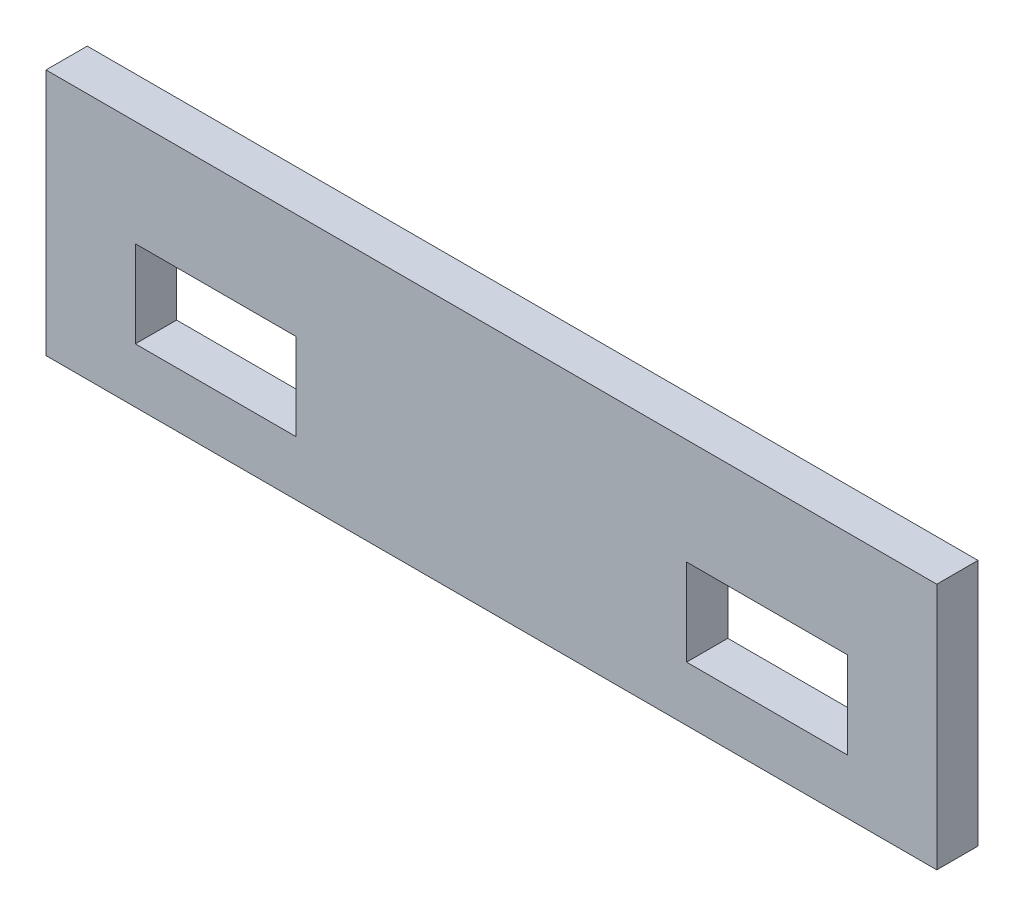
from build123d import *

# Parameters (mm, degrees)
SK_BODY_W               = 324
SK_BODY_H               = 90
EX_BODY_DEPTH           = 15
SK_SWITCHPOCKETS_W      = 20
SK_SWITCHPOCKETS_H      = 12
CUT_SWITCHPOCKETS_DEPTH = 8
SK_GUIDEPINS_R          = 2.5
CUT_GUIDEPINS_DEPTH     = 10
SK_CLIFFWINDOWS_W       = 58.5
SK_CLIFFWINDOWS_H       = 31.552578851
CUT_CLIFFWINDOWS_DEPTH  = 15


with BuildPart() as part:
    # SK_Body → EX_Body (new body)
    with BuildSketch(Plane.XY):
        with Locations((0, 45)):
            Rectangle(SK_BODY_W, SK_BODY_H)
    extrude(amount=EX_BODY_DEPTH)

    # SK_SwitchPockets → CUT_SwitchPockets (cut)
    with BuildSketch(Plane.XY):
        with Locations((55, 45)):
            Rectangle(SK_SWITCHPOCKETS_W, SK_SWITCHPOCKETS_H)
        with Locations((-55, 45)):
            Rectangle(SK_SWITCHPOCKETS_W, SK_SWITCHPOCKETS_H)
    extrude(amount=CUT_SWITCHPOCKETS_DEPTH, mode=Mode.SUBTRACT)

    # SK_GuidePins → CUT_GuidePins (cut)
    with BuildSketch(Plane.XY):
        with Locations((150, 20)):
            Circle(SK_GUIDEPINS_R)
        with Locations((-150, 20)):
            Circle(SK_GUIDEPINS_R)
    extrude(amount=CUT_GUIDEPINS_DEPTH, mode=Mode.SUBTRACT)

    # SK_CliffWindows → CUT_CliffWindows (cut)
    with BuildSketch(Plane.XY):
        with Locations((100.25, 35.723710575)):
            Rectangle(SK_CLIFFWINDOWS_W, SK_CLIFFWINDOWS_H)
        with Locations((-100.25, 35.723710575)):
            Rectangle(SK_CLIFFWINDOWS_W, SK_CLIFFWINDOWS_H)
    extrude(amount=CUT_CLIFFWINDOWS_DEPTH, mode=Mode.SUBTRACT)


solid = part.part
